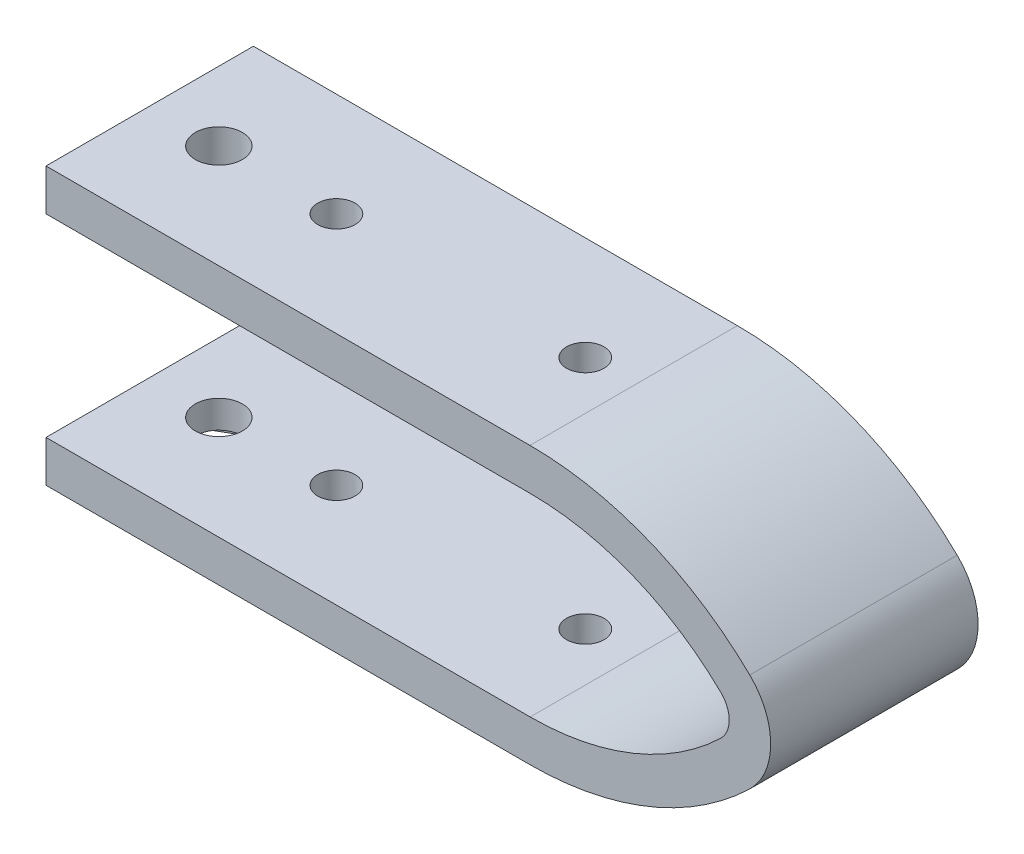
from build123d import *

# Parameters (mm, degrees)
BOSS_EXTRUDE1_DEPTH = 15
SKETCH2_R           = 1.7
SKETCH2_R_2         = 1.35
CUT_EXTRUDE1_DEPTH  = 59.066473529
CUT_EXTRUDE2_DEPTH  = 1


with BuildPart() as part:
    # Sketch1 → Boss-Extrude1 (new body)
    with BuildSketch(Plane.XY):
        with BuildLine():
            Line((0, 0), (35, 0))
            ThreePointArc((35, 0), (43.574008742, 1.66873563), (50.896306384, 6.431325448))
            ThreePointArc((50.896306384, 6.431325448), (52.409115124, 10), (50.896306384, 13.568674552))
            ThreePointArc((50.896306384, 13.568674552), (43.574008742, 18.33126437), (35, 20))
            Line((35, 20), (0, 20))
            Line((0, 20), (0, 17))
            Line((0, 17), (35.015119776, 17))
            ThreePointArc((35.015119776, 17), (42.445641677, 15.557658707), (48.796934125, 11.440124447))
            ThreePointArc((48.796934125, 11.440124447), (49.409115124, 10), (48.796934125, 8.559875553))
            ThreePointArc((48.796934125, 8.559875553), (42.445641677, 4.442341293), (35.015119776, 3))
            Line((35.015119776, 3), (0, 3))
            Line((0, 3), (0, 0))
        make_face()
    extrude(amount=BOSS_EXTRUDE1_DEPTH)

    # Sketch2 → Cut-Extrude1 (cut, through all)
    with BuildSketch(Plane(origin=(0, 20, 0), x_dir=(1, 0, 0), z_dir=(0, 1, 0))):
        with Locations(Location((5, -7.5, 0), (0, 0, 270))):
            Circle(SKETCH2_R)
        with Locations(Location((13.5, -7.5, 0), (0, 0, 270))):
            Circle(SKETCH2_R_2)
        with Locations(Location((31.5, -7.5, 0), (0, 0, 270))):
            Circle(SKETCH2_R_2)
    extrude(amount=-CUT_EXTRUDE1_DEPTH, mode=Mode.SUBTRACT)

    # Sketch3 → Cut-Extrude2 (cut)
    with BuildSketch(Plane.XZ):
        Polygon((5, 10.848631561), (2.1, 9.174315781), (2.1, 5.825684219), (5, 4.151368439), (7.9, 5.825684219), (7.9, 9.174315781), align=None)
    extrude(amount=-CUT_EXTRUDE2_DEPTH, mode=Mode.SUBTRACT)


solid = part.part
